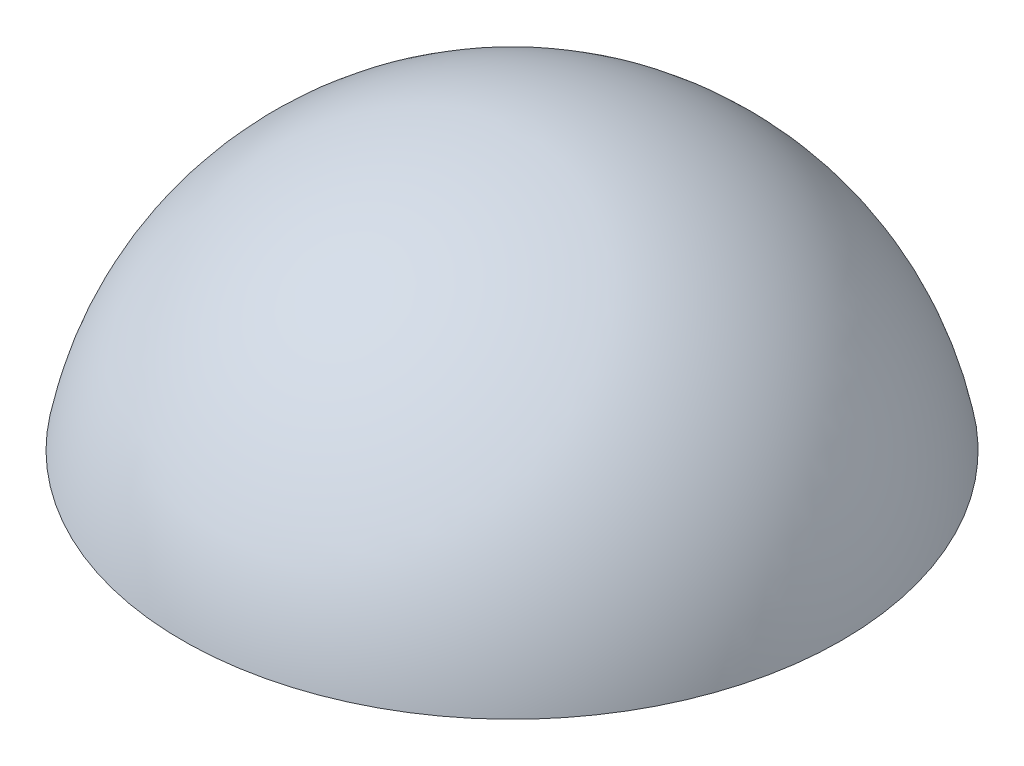
from build123d import *

# Parameters (mm, degrees)
SHELL1_T                = 76.2
CUT_EXTRUDE1_REACH      = 1437.718
CUT_EXTRUDE1_END_RADIUS = 838.2
SKETCH3_R               = 254


with BuildPart() as part:
    # Sketch2 → Revolve1 (revolve)
    with BuildSketch(Plane.XY):
        with BuildLine():
            Line((0, 762), (0, 152.4))
            Line((0, 152.4), (746.6044736, 152.4))
            ThreePointArc((746.6044736, 152.4), (481.93111541, 590.242661962), (0, 762))
        make_face()
    revolve(axis=Axis((0, 762, 0), (0, -1, 0)))

    # Shell1
    shell1_openings = [part.faces().sort_by_distance(p)[0] for p in [
        (0, 152.4, 0),
    ]]
    offset(amount=SHELL1_T, openings=shell1_openings, kind=Kind.INTERSECTION)

    # Cut-Extrude1: up to this sphere (the profile starts inside it)
    cut_extrude1_end = Location((0, 0, 0)) * Sphere(CUT_EXTRUDE1_END_RADIUS, mode=Mode.PRIVATE)
    # Sketch3 → Cut-Extrude1 (cut, up to the surface)
    with BuildSketch(Plane(origin=(0, 0, 0), x_dir=(0, 0, -1), z_dir=(1, 0, 0)), mode=Mode.PRIVATE) as cut_extrude1_sk1:
        Circle(SKETCH3_R)
    cut_extrude1_tool1 = extrude(cut_extrude1_sk1.sketch, amount=-CUT_EXTRUDE1_REACH, mode=Mode.PRIVATE) & cut_extrude1_end
    add(cut_extrude1_tool1.solids().sort_by_distance((0, 0, 0))[0], mode=Mode.SUBTRACT)


solid = part.part
